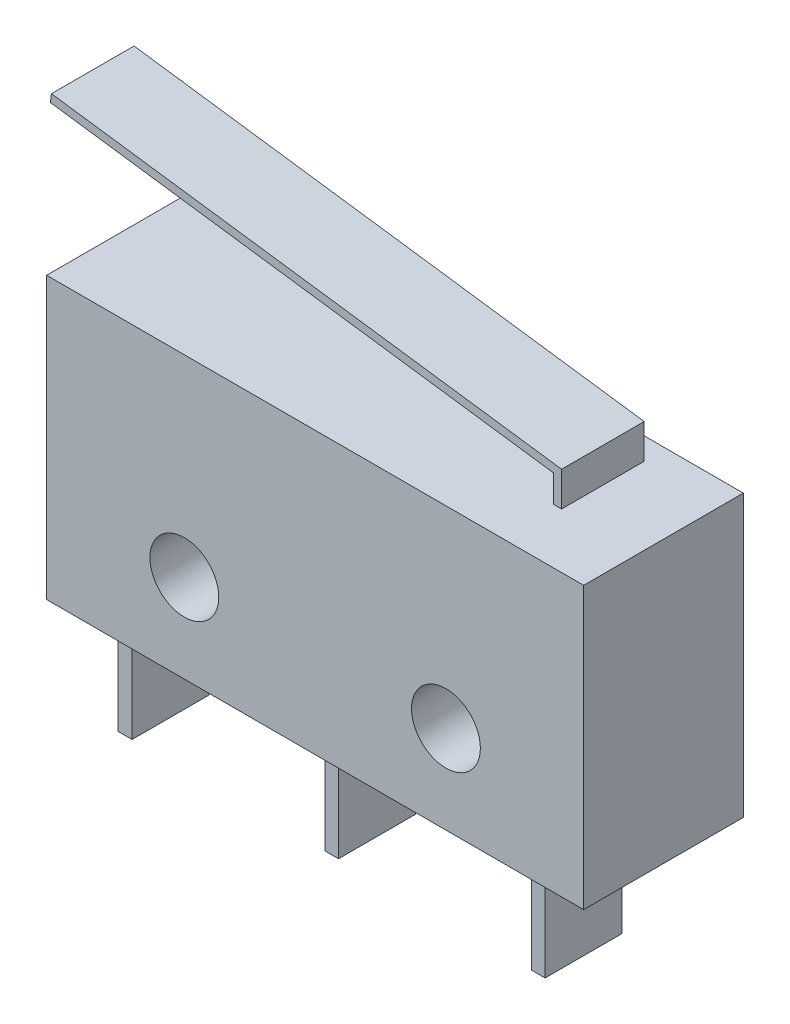
from build123d import *

# Parameters (mm, degrees)
SKETCH1_W                      = 19.5
SKETCH1_H                      = 10.2
BOSS_EXTRUDE1_DEPTH            = 5.8
SKETCH4_W                      = 0.5
SKETCH4_H                      = 2.8
BOSS_EXTRUDE4_DEPTH            = 3.2
SKETCH5_W                      = 0.5
SKETCH5_H                      = 2.8
BOSS_EXTRUDE5_DEPTH            = 3.2
SKETCH6_W                      = 0.5
SKETCH6_H                      = 2.8
BOSS_EXTRUDE6_DEPTH            = 3.2
F_2_5_2_5_DIAMETER_HOLE1_D     = 2.5
F_2_5_2_5_DIAMETER_HOLE1_DEPTH = 10
F_2_5_2_5_DIAMETER_HOLE1_TIP   = 0.751075774
BOSS_EXTRUDE7_DEPTH            = 3


with BuildPart() as part:
    # Sketch1 → Boss-Extrude1 (new body)
    with BuildSketch(Plane.XY.offset(5)):
        with Locations((-9.915879305, -7.543983402)):
            Rectangle(SKETCH1_W, SKETCH1_H)
    extrude(amount=-BOSS_EXTRUDE1_DEPTH)

    # Sketch4 → Boss-Extrude4 (add)
    with BuildSketch(Plane.XZ.offset(12.643983402)):
        with Locations((-9.665879305, 3.25)):
            Rectangle(SKETCH4_W, SKETCH4_H)
    extrude(amount=BOSS_EXTRUDE4_DEPTH)

    # Sketch5 → Boss-Extrude5 (add)
    with BuildSketch(Plane.XZ.offset(12.643983402)):
        with Locations((-17.165879305, 3.25)):
            Rectangle(SKETCH5_W, SKETCH5_H)
    extrude(amount=BOSS_EXTRUDE5_DEPTH)

    # Sketch6 → Boss-Extrude6 (add)
    with BuildSketch(Plane.XZ.offset(12.643983402)):
        with Locations((-2.165879305, 3.25)):
            Rectangle(SKETCH6_W, SKETCH6_H)
    extrude(amount=BOSS_EXTRUDE6_DEPTH)

    # Ø2.5 (2.5) Diameter Hole1
    with Locations(Plane(origin=(0, 0, -0.8), x_dir=(-1, 0, 0), z_dir=(0, 0, -1))):
        with Locations((14.665879305, -9.443983402), (5.165879305, -9.443983402)):
            Hole(F_2_5_2_5_DIAMETER_HOLE1_D / 2, depth=F_2_5_2_5_DIAMETER_HOLE1_DEPTH)
            with Locations((0, 0, -(F_2_5_2_5_DIAMETER_HOLE1_DEPTH + F_2_5_2_5_DIAMETER_HOLE1_TIP / 2))):  # 118° drill point
                Cone(0, F_2_5_2_5_DIAMETER_HOLE1_D / 2, F_2_5_2_5_DIAMETER_HOLE1_TIP, mode=Mode.SUBTRACT)

    # Sketch9 → Boss-Extrude7 (add)
    with BuildSketch(Plane.XY):
        Polygon((-2.965879305, -1.193983402), (-2.965879305, -2.443983402), (-3.265879305, -2.443983402), (-3.265879305, -1.455557189), (-21.532448725, 1.056016598), (-21.491584492, 1.353220424), align=None)
    extrude(amount=BOSS_EXTRUDE7_DEPTH)


solid = part.part
